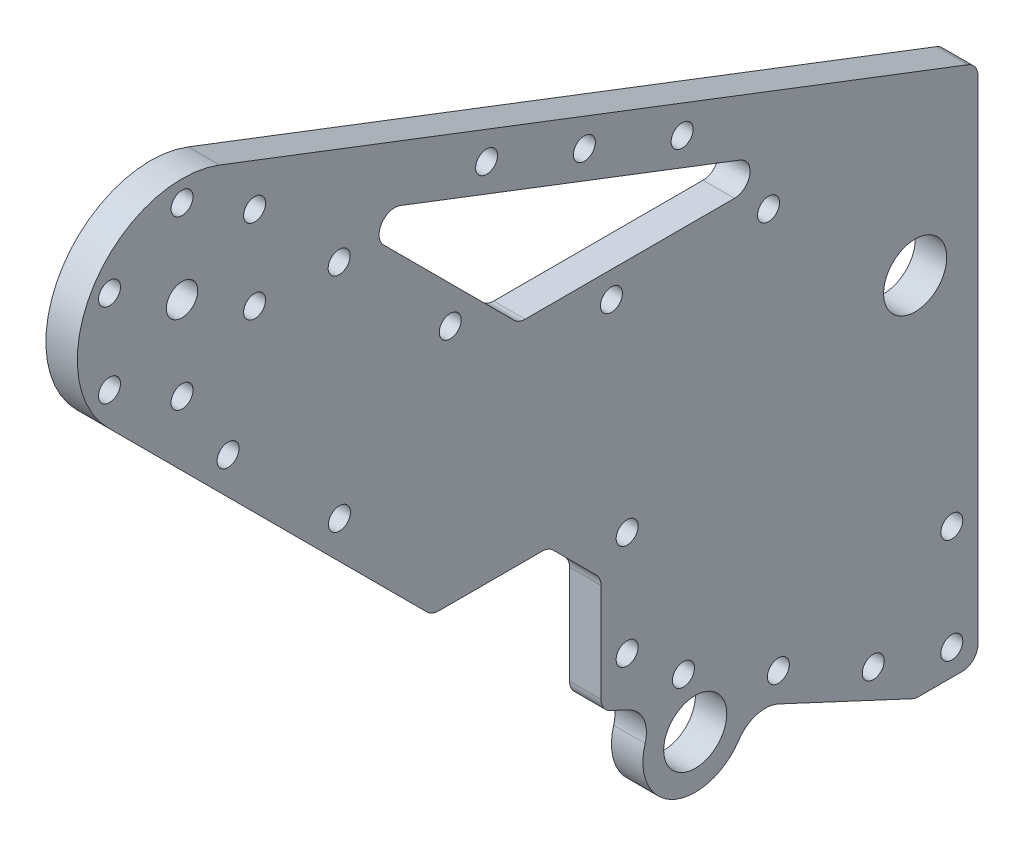
from build123d import *

# Parameters (mm, degrees)
SKETCH_1_R               = 6.025
EXTRUDE_1_DEPTH          = 3
SKETCH_2_R               = 3
SKETCH_2_R_2             = 2.1
CUT_EXTRUDE_1_DEPTH      = 10
SKETCH_4_R               = 2.1
CUT_EXTRUDE_3_DEPTH      = 10
CHAMFER_1_SIZE           = 10
FILLET_1_R               = 3
SKETCH_5_R               = 2.1
CUT_EXTRUDE_4_DEPTH      = 10
EXTRUDE_2_DEPTH          = 6
CUT_EXTRUDE_6_DEPTH      = 182.747077005
CUT_EXTRUDE_6_DEPTH_BACK = 182.747077005
EXTRUDE_START            = -6
SKETCH_7_R               = 2.1
EXTRUDE_3_DEPTH          = 6


with BuildPart() as part:
    # 草图1 → 凸台-拉伸1 (new, symmetric)
    with BuildSketch(Plane(origin=(0, 0, 0), x_dir=(0, 0, -1), z_dir=(1, 0, 0))):
        with BuildLine():
            Line((-60, -42.021540511), (0, -70))
            Line((0, -70), (12, -70))
            Line((12, -70), (12, 30))
            Line((12, 30), (-75.715728753, 30))
            Line((-75.715728753, 30), (-125.857864376, 80.142135624))
            ThreePointArc((-125.857864376, 80.142135624), (-154.142135624, 80.142135624), (-154.142135624, 51.857864376))
            Line((-154.142135624, 51.857864376), (-92.284271247, -10))
            Line((-92.284271247, -10), (-60, -10))
            Line((-60, -10), (-60, -42.021540511))
        make_face()
        Circle(SKETCH_1_R, mode=Mode.SUBTRACT)
    extrude(amount=EXTRUDE_1_DEPTH, both=True)

    # 草图2 → 切除-拉伸1 (cut)
    with BuildSketch(Plane(origin=(3, 0, 0), x_dir=(0, 0, -1), z_dir=(1, 0, 0))):
        with Locations((-140, 66)):
            Circle(SKETCH_2_R)
        with Locations((-140, 82)):
            Circle(SKETCH_2_R_2)
        with Locations((-126.143593539, 74)):
            Circle(SKETCH_2_R_2)
        with Locations((-126.143593539, 58)):
            Circle(SKETCH_2_R_2)
        with Locations((-140, 50)):
            Circle(SKETCH_2_R_2)
        with Locations((-153.856406461, 58)):
            Circle(SKETCH_2_R_2)
        with Locations((-153.856406461, 74)):
            Circle(SKETCH_2_R_2)
    extrude(amount=-CUT_EXTRUDE_1_DEPTH, mode=Mode.SUBTRACT)

    # 草图4 → 切除-拉伸3 (cut)
    with BuildSketch(Plane(origin=(3, 0, 0), x_dir=(0, 0, -1), z_dir=(1, 0, 0))):
        with Locations((-55, -15)):
            Circle(SKETCH_4_R)
        with Locations((-55, -35)):
            Circle(SKETCH_4_R)
        with Locations((7, -65)):
            Circle(SKETCH_4_R)
        with Locations((7, -45)):
            Circle(SKETCH_4_R)
        with Locations((-8, -60.75264914)):
            Circle(SKETCH_4_R)
        with Locations((-26.126155741, -52.300283905)):
            Circle(SKETCH_4_R)
        with Locations((-44.252311481, -43.84791867)):
            Circle(SKETCH_4_R)
    extrude(amount=-CUT_EXTRUDE_3_DEPTH, mode=Mode.SUBTRACT)

    # 倒角1
    chamfer_1_edges = [part.edges().sort_by_distance(p)[0] for p in [
        (0, -10, 60),
    ]]
    chamfer(chamfer_1_edges, length=CHAMFER_1_SIZE)

    # 圆角1
    fillet_1_edges = [part.edges().sort_by_distance(p)[0] for p in [
        (0, -20, 60),
        (0, -10, 70),
        (0, 30, -12),
        (0, -70, -12),
        (0, -70, 0),
        (0, -42.021540511, 60),
        (0, -10, 92.284271247),
        (0, 30, 75.715728753),
    ]]
    fillet(fillet_1_edges, radius=FILLET_1_R)

    # 草图5 → 切除-拉伸4 (cut)
    with BuildSketch(Plane(origin=(3, 0, 0), x_dir=(0, 0, -1), z_dir=(1, 0, 0))):
        with Locations((-110, 57.213203436)):
            Circle(SKETCH_5_R)
        with Locations((-88.786796564, 36)):
            Circle(SKETCH_5_R)
        with Locations((-109.946763354, 14.785654888)):
            Circle(SKETCH_5_R)
        with Locations((-131.214342006, 35.94434337)):
            Circle(SKETCH_5_R)
        with Locations((-58, 25)):
            Circle(SKETCH_5_R)
        with Locations((-28, 25)):
            Circle(SKETCH_5_R)
    extrude(amount=-CUT_EXTRUDE_4_DEPTH, mode=Mode.SUBTRACT)

    # 草图6 → 凸台-拉伸2 (add)
    with BuildSketch(Plane.ZY.offset(3)):
        with BuildLine():
            Line((36.127383127, -53.153524579), (26.084776747, -57.836468842))
            ThreePointArc((26.084776747, -57.836468842), (30.261373424, -57.503051447), (33.637803948, -59.983947227))
            ThreePointArc((33.637803948, -59.983947227), (46.226182617, -63.56307787), (51.576063312, -51.619199512))
            ThreePointArc((51.576063312, -51.619199512), (51.845914592, -47.438014603), (54.785991728, -44.452872497))
            Line((54.785991728, -44.452872497), (44.743385348, -49.13581676))
            ThreePointArc((44.743385348, -49.13581676), (47.139529245, -51.355820594), (48.025, -54.5))
            ThreePointArc((48.025, -54.5), (41.322464636, -60.486783012), (36.127383127, -53.153524579))
        make_face()
    extrude(amount=-EXTRUDE_2_DEPTH)

    # 草图6<3> → 切除-拉伸6 (cut, two sides: drawn at the far end of the back side and taken through both)
    with BuildSketch(Plane.ZY.offset(3).offset(-CUT_EXTRUDE_6_DEPTH_BACK)):
        with BuildLine():
            ThreePointArc((44.743385348, -49.13581676), (39.453724973, -49.039495583), (36.127383127, -53.153524579))
            Line((36.127383127, -53.153524579), (44.743385348, -49.13581676))
        make_face()
        with BuildLine():
            Line((44.743385348, -49.13581676), (36.127383127, -53.153524579))
            ThreePointArc((36.127383127, -53.153524579), (41.322464636, -60.486783012), (48.025, -54.5))
            ThreePointArc((48.025, -54.5), (47.139529245, -51.355820594), (44.743385348, -49.13581676))
        make_face()
    extrude(amount=CUT_EXTRUDE_6_DEPTH + CUT_EXTRUDE_6_DEPTH_BACK, mode=Mode.SUBTRACT)

    # 草图7 → 凸台-拉伸3 (add)
    with BuildSketch(Plane.ZY.offset(3).offset(EXTRUDE_START)):
        with BuildLine():
            ThreePointArc((98.29636037, 60.699261849), (101.887641952, 59.532632956), (101.49301897, 55.777290218))
            Line((101.49301897, 55.777290218), (125.857864376, 80.142135624))
            ThreePointArc((125.857864376, 80.142135624), (129.106517373, 82.772955502), (132.83107829, 84.671008583))
            Line((132.83107829, 84.671008583), (-10.075338256, 29.800651288))
            ThreePointArc((-10.075338256, 29.800651288), (-9.546830018, 29.949741841), (-9, 30))
            Line((-9, 30), (34.524823416, 30))
            ThreePointArc((34.524823416, 30), (31.575081575, 32.453169982), (33.44948516, 35.800651288))
            Line((33.44948516, 35.800651288), (98.29636037, 60.699261849))
        make_face()
        with Locations((44.499091861, 45.39915608)):
            Circle(SKETCH_7_R, mode=Mode.SUBTRACT)
        with Locations((63.170100444, 52.56807779)):
            Circle(SKETCH_7_R, mode=Mode.SUBTRACT)
        with Locations((81.841109028, 59.736999499)):
            Circle(SKETCH_7_R, mode=Mode.SUBTRACT)
    extrude(amount=EXTRUDE_3_DEPTH)


solid = part.part
